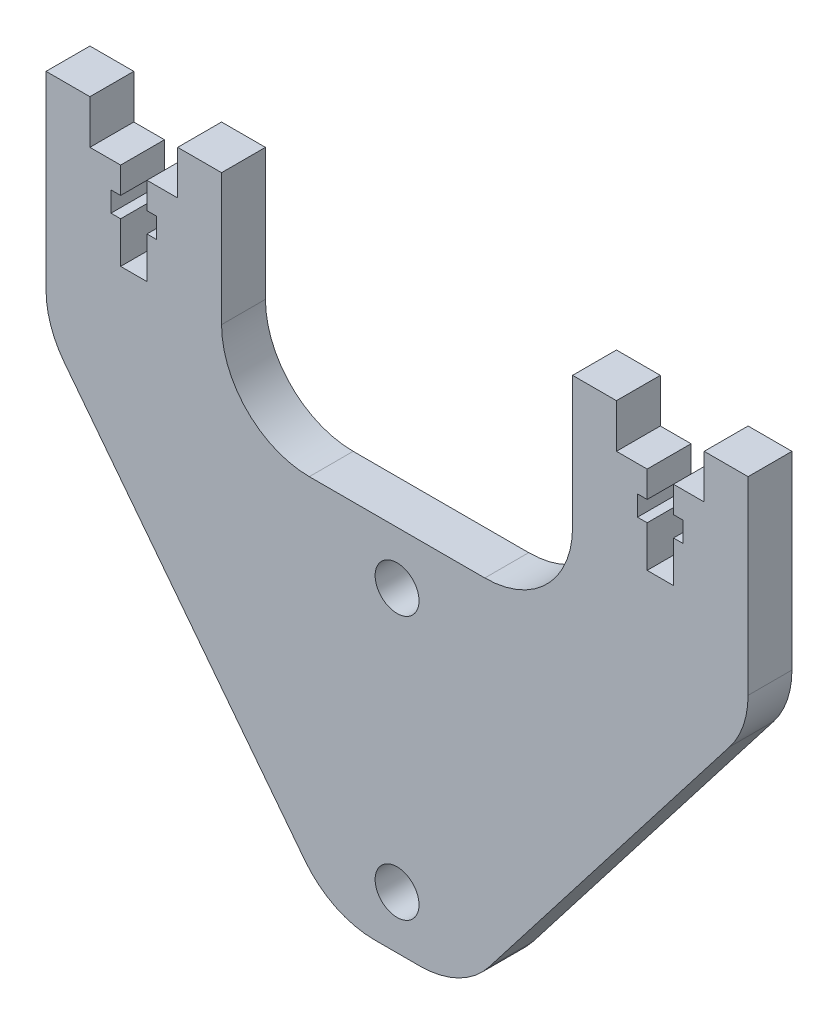
from build123d import *

# Parameters (mm, degrees)
ESQUISSE1_R        = 2.5
BOSS_EXTRU_1_DEPTH = 5
CONG_1_R           = 10


with BuildPart() as part:
    # Esquisse1 → Boss.-Extru.1 (new body)
    with BuildSketch(Plane.XY):
        Polygon((-40, 5), (-40, 0), (-40, -20), (-7.5, -62), (7.5, -62), (40, -20), (40, 0), (40, 5), (35, 5), (35, 0), (31.5, 0), (31.5, -3), (32.6, -3), (32.6, -5.3), (31.5, -5.3), (31.5, -10), (28.5, -10), (28.5, -5.3), (27.4, -5.3), (27.4, -3), (28.5, -3), (28.5, 0), (25, 0), (25, 5), (20, 5), (20, 0), (20, -20), (-20, -20), (-20, 0), (-20, 5), (-25, 5), (-25, 0), (-28.5, 0), (-28.5, -3), (-27.4, -3), (-27.4, -5.3), (-28.5, -5.3), (-28.5, -10), (-31.5, -10), (-31.5, -5.3), (-32.6, -5.3), (-32.6, -3), (-31.5, -3), (-31.5, 0), (-35, 0), (-35, 5), align=None)
        with Locations((0, -56)):
            Circle(ESQUISSE1_R, mode=Mode.SUBTRACT)
        with Locations((0, -26)):
            Circle(ESQUISSE1_R, mode=Mode.SUBTRACT)
    extrude(amount=BOSS_EXTRU_1_DEPTH)

    # Congé1
    cong_1_edges = [part.edges().sort_by_distance(p)[0] for p in [
        (-20, -20, 2.5),
        (20, -20, 2.5),
        (40, -20, 2.5),
        (7.5, -62, 2.5),
        (-7.5, -62, 2.5),
        (-40, -20, 2.5),
    ]]
    fillet(cong_1_edges, radius=CONG_1_R)


solid = part.part
